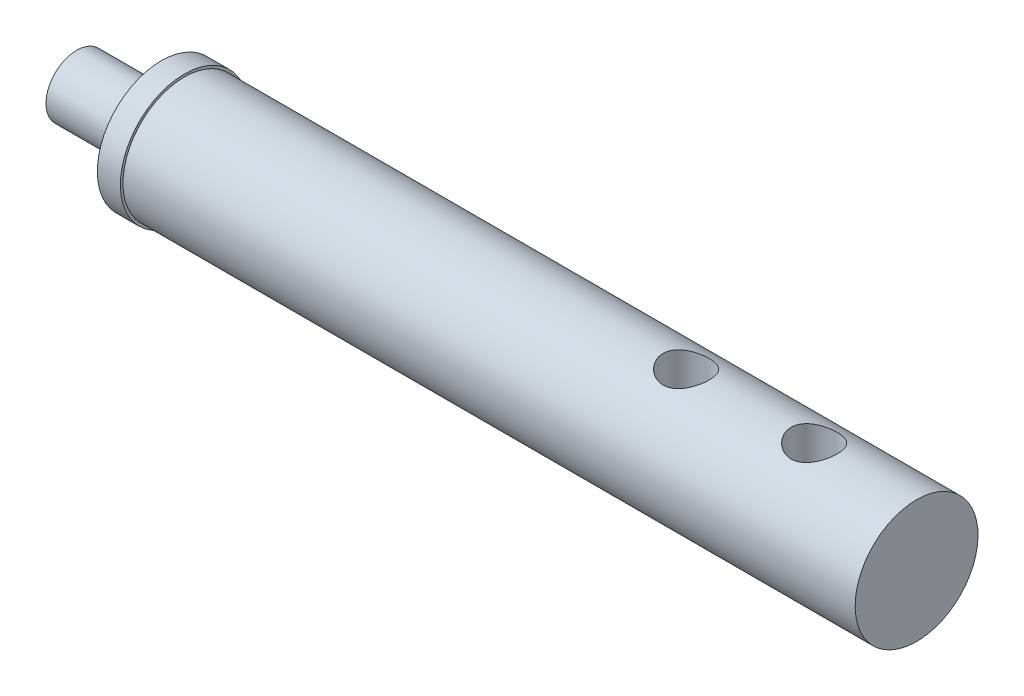
from build123d import *

# Parameters (mm, degrees)
CUT_EXTRUDE1_DEPTH      = 111.105444252
CUT_EXTRUDE1_DEPTH_BACK = 111.105444252
SKETCH2_R               = 4.5


with BuildPart() as part:
    # Sketch1 → Revolve1 (revolve)
    with BuildSketch(Plane.XY):
        Polygon((108.677085229, 12), (-34.322914771, 12), (-34.322914771, 12.5), (-38.822914771, 12.5), (-38.822914771, 6), (-55.352914771, 6), (-55.352914771, 0), (108.677085229, 0), align=None)
    revolve(axis=Axis((108.677085229, 0, 0), (-1, 0, 0)))

    # Sketch2 → Cut-Extrude1 (cut, two sides: drawn at the far end of the back side and taken through both)
    with BuildSketch(Plane(origin=(0, 0, 0), x_dir=(1, 0, 0), z_dir=(0, 1, 0)).offset(-CUT_EXTRUDE1_DEPTH_BACK)):
        with Locations(Location((88.677085229, 0, 0), (0, 0, 270))):
            Circle(SKETCH2_R)
        with Locations(Location((63.677085229, 0, 0), (0, 0, 270))):
            Circle(SKETCH2_R)
    extrude(amount=CUT_EXTRUDE1_DEPTH + CUT_EXTRUDE1_DEPTH_BACK, mode=Mode.SUBTRACT)


solid = part.part
